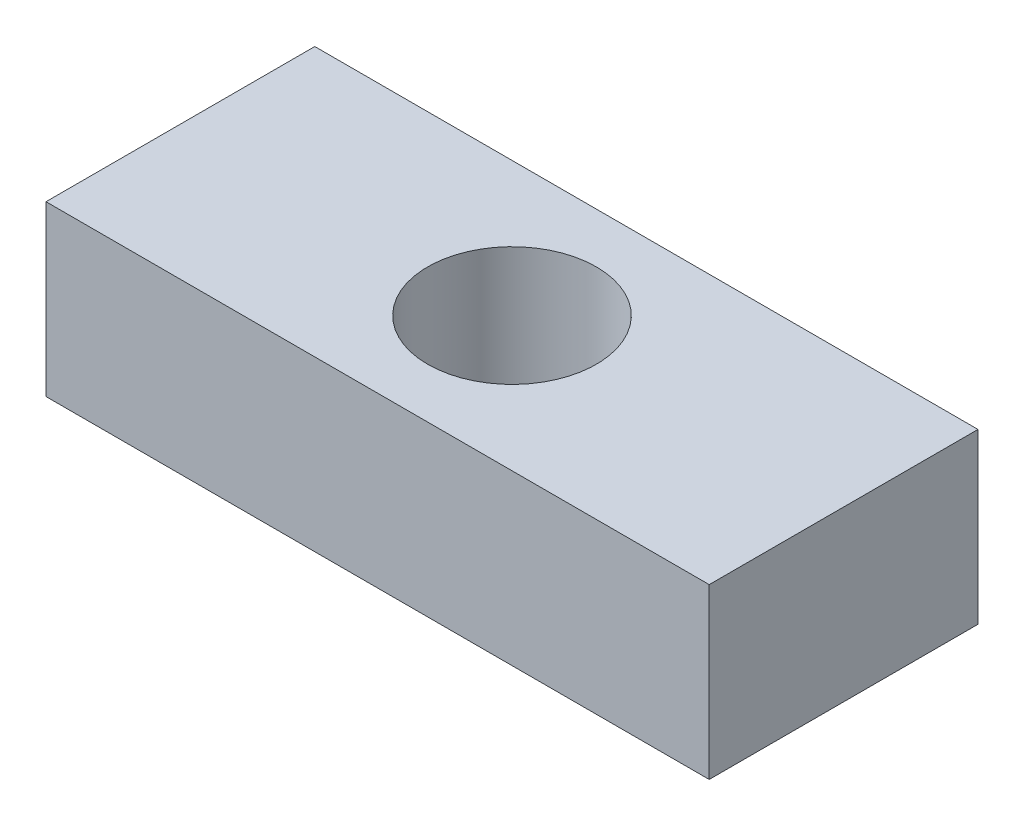
from build123d import *

# Parameters (mm, degrees)
SKETCH1_W           = 9.482701824
SKETCH1_H           = 3.843267732
SKETCH1_R           = 1.2065
BOSS_EXTRUDE1_DEPTH = 2.413


with BuildPart() as part:
    # Sketch1 → Boss-Extrude1 (new body)
    with BuildSketch(Plane(origin=(0, 0, 0), x_dir=(1, 0, 0), z_dir=(0, 1, 0))):
        Rectangle(SKETCH1_W, SKETCH1_H)
        with Locations(Location((0, 0, 0), (0, 0, 270))):
            Circle(SKETCH1_R, mode=Mode.SUBTRACT)
    extrude(amount=BOSS_EXTRUDE1_DEPTH)


solid = part.part
